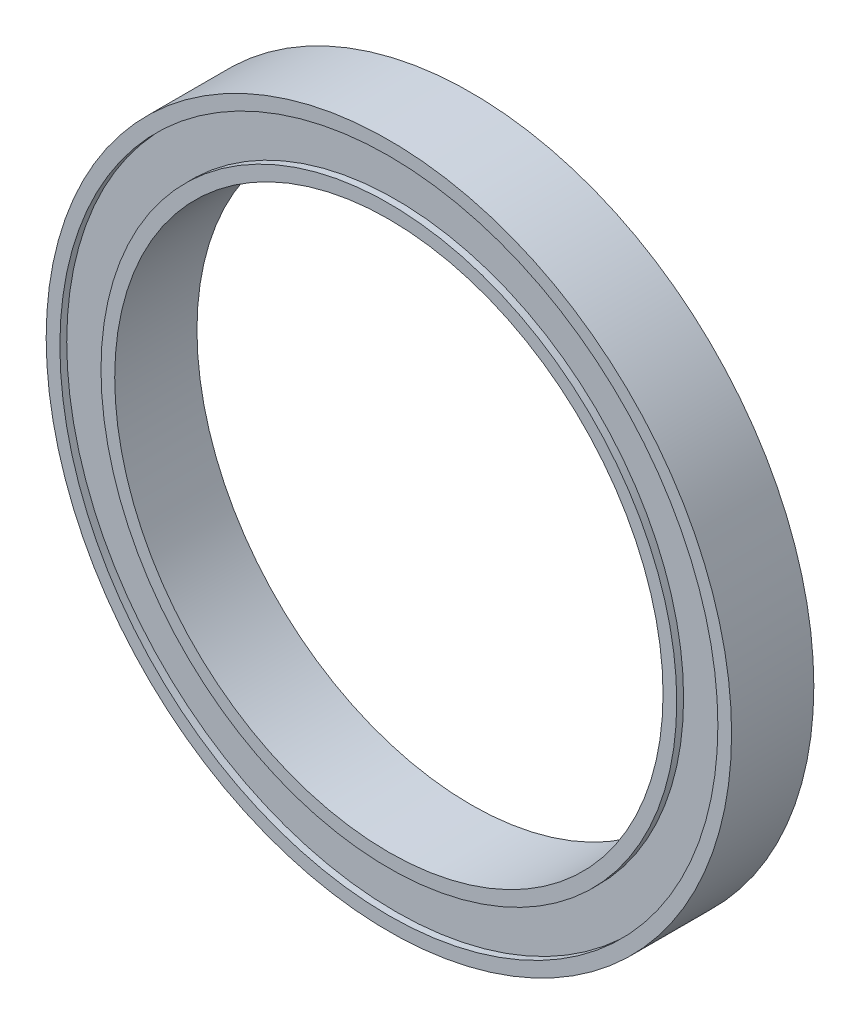
from build123d import *

# Parameters (mm, degrees)
SKETCH1_W = 6
SKETCH1_H = 5
SKETCH3_W = 0.5
SKETCH3_H = 3


with BuildPart() as part:
    # Sketch1 → Revolve1 (revolve)
    with BuildSketch(Plane(origin=(0, 0, 0), x_dir=(0, 0, -1), z_dir=(1, 0, 0)), mode=Mode.PRIVATE) as revolve1_sk:
        with Locations((0, 22.5)):
            Rectangle(SKETCH1_W, SKETCH1_H)
    revolve(revolve1_sk.sketch.rotate(Axis((0, 0, 0), (0, 0, -1)), 90), axis=Axis((0, 0, 0), (0, 0, -1)))

    # Sketch3 → Cut-Revolve2 (revolve, cut)
    with BuildSketch(Plane(origin=(0, 0, 0), x_dir=(0, 0, -1), z_dir=(1, 0, 0)), mode=Mode.PRIVATE) as cut_revolve2_sk:
        with Locations((2.75, 22.5)):
            Rectangle(SKETCH3_W, SKETCH3_H)
        with Locations((-2.75, 22.5)):
            Rectangle(SKETCH3_W, SKETCH3_H)
    revolve(cut_revolve2_sk.sketch.rotate(Axis((0, 0, 0), (0, 0, -1)), 90), axis=Axis((0, 0, 0), (0, 0, -1)), mode=Mode.SUBTRACT)


solid = part.part
